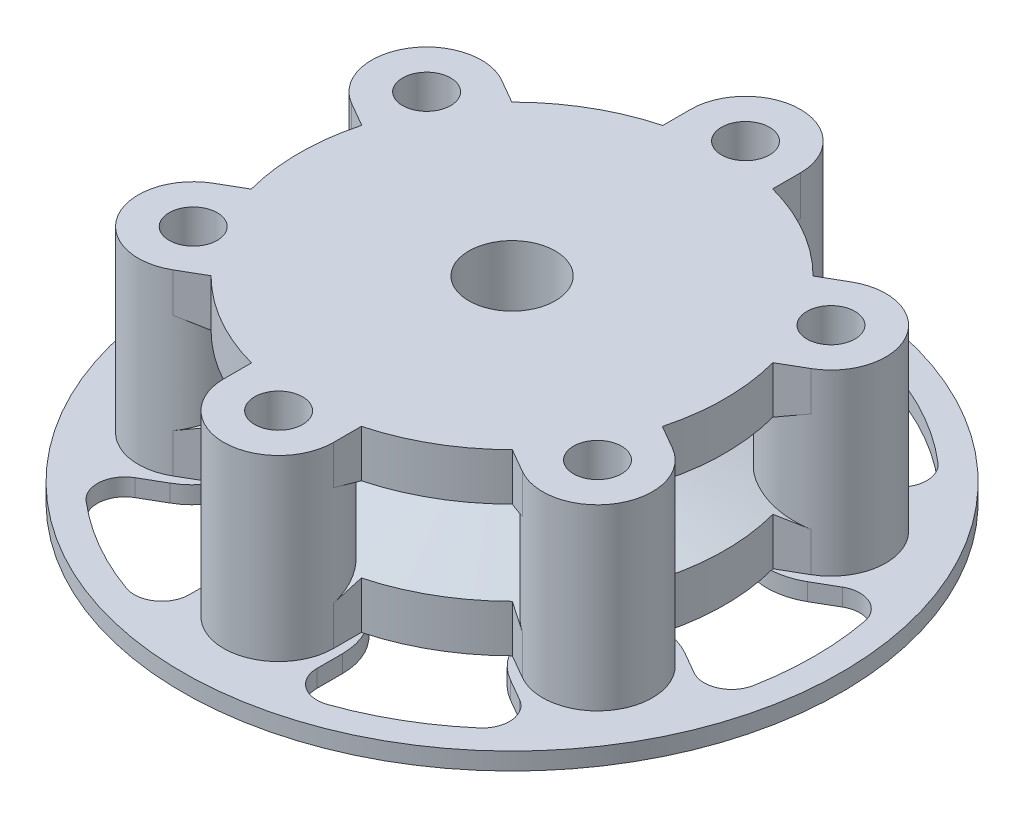
from build123d import *
from build123d.topology import SkipClean

# Parameters (mm, degrees)
SKETCH1_R                = 31.75
BOSS_EXTRUDE1_DEPTH      = 8.255
CUT_EXTRUDE4_DEPTH       = 0.635
CIRPATTERN2_COUNT        = 20
BOSS_EXTRUDE2_REACH      = 46.486
SKETCH5_R                = 5.08
SKETCH5_R_2              = 2.2225
BOSS_EXTRUDE6_REACH      = 46.486
SKETCH12_R               = 5.08
SKETCH17_R               = 2.2225
CUT_EXTRUDE5_DEPTH       = 43.125921197
CIRPATTERN1_COUNT        = 3
BOSS_EXTRUDE9_REACH      = 41.36
SKETCH18_R               = 10.16
FILLET5_R                = 1.27
SKETCH24_R               = 4
CUT_EXTRUDE7_DEPTH       = 40.360360407
SKETCH30_R               = 30.48
SKETCH30_R_2             = 27.94
BOSS_EXTRUDE16_DEPTH     = 1.6002
SKETCH31_R               = 2.7305
BOSS_EXTRUDE17_DEPTH     = 1.6002
FILLET6_R                = 2.54
CIRPATTERN8_COUNT        = 6
FILLET6_OF_CIRPATTERN8_R = 2.54


with BuildPart() as part:
    # Sketch1 → Boss-Extrude1 (new, symmetric)
    with BuildSketch(Plane(origin=(0, 0, 0), x_dir=(1, 0, 0), z_dir=(0, 1, 0))):
        with Locations(Location((0, 0, 0), (0, 0, 270))):
            Circle(SKETCH1_R)
    extrude(amount=BOSS_EXTRUDE1_DEPTH, both=True)

    # Sketch9 → Cut-Extrude4 (cut)
    with BuildSketch(Plane.ZY.offset(31.75)):
        Polygon((-0.635, -8.255), (0.635, -8.255), (0.635, 0), (0.635, 8.255), (-0.635, 8.255), (-0.635, 0), align=None)
    cut_extrude4 = extrude(amount=-CUT_EXTRUDE4_DEPTH, mode=Mode.SUBTRACT)

    # CirPattern2: Cut-Extrude4 ×20 about axis
    cirpattern2_axis = Axis((0, 0, 0), (0, 1, 0))
    for i in range(1, CIRPATTERN2_COUNT):
        add(cut_extrude4.rotate(cirpattern2_axis, i * 360 / CIRPATTERN2_COUNT), mode=Mode.SUBTRACT)

    # Sketch4 → Cut-Revolve2 (revolve, cut)
    with BuildSketch(Plane.XY, mode=Mode.PRIVATE) as cut_revolve2_sk:
        Polygon((-31.75, -8.255), (-29.21, -8.255), (-29.21, -6.6675), (-6.35, 0), (-29.21, 6.6675), (-29.21, 8.255), (-31.75, 8.255), align=None)
    revolve(cut_revolve2_sk.sketch.rotate(Axis((0, -9.433909364, 0), (0, 1, 0)), 270), axis=Axis((0, -9.433909364, 0), (0, 1, 0)), mode=Mode.SUBTRACT)

    # Sketch5 → Boss-Extrude2 (add, up to next)
    with BuildSketch(Plane(origin=(0, 8.255, 0), x_dir=(1, 0, 0), z_dir=(0, 1, 0)), mode=Mode.PRIVATE) as boss_extrude2_sk1:
        with Locations(Location((0, 21.59, 0), (0, 0, 269.999999942))):
            Circle(SKETCH5_R)
        with Locations(Location((0, 21.59, 0), (0, 0, 138.641608493))):
            Circle(SKETCH5_R_2, mode=Mode.SUBTRACT)
    boss_extrude2_tool1 = extrude(boss_extrude2_sk1.sketch, amount=-BOSS_EXTRUDE2_REACH, mode=Mode.PRIVATE) - part.part
    boss_extrude2 = boss_extrude2_tool1.solids().sort_by_distance((0, 8.255, -26.526316))[0]
    add(boss_extrude2)

    # Sketch12 → Boss-Extrude6 (add, up to next)
    with BuildSketch(Plane(origin=(0, 8.255, 0), x_dir=(1, 0, 0), z_dir=(0, 1, 0)), mode=Mode.PRIVATE) as boss_extrude6_sk1:
        with Locations(Location((-18.697488468, 10.795, 0), (0, 0, 134.395917387))):
            Circle(SKETCH12_R)
    boss_extrude6_tool1 = extrude(boss_extrude6_sk1.sketch, amount=-BOSS_EXTRUDE6_REACH, mode=Mode.PRIVATE) - part.part
    boss_extrude6 = boss_extrude6_tool1.solids().sort_by_distance((-18.697488, 8.255, -10.795))[0]
    add(boss_extrude6)

    # Sketch17 → Cut-Extrude5 (cut, symmetric)
    with SkipClean():  # the faces are left unmerged after this step: merging them gives an invalid solid
        with BuildSketch(Plane(origin=(0, 0, 0), x_dir=(1, 0, 0), z_dir=(0, 1, 0))):
            with Locations(Location((0, 21.59, 0), (0, 0, 270))):
                Circle(SKETCH17_R)
            with Locations(Location((-18.697488468, 10.795, 0), (0, 0, 270))):
                Circle(SKETCH17_R)
            with Locations(Location((-18.697488468, -10.795, 0), (0, 0, 270))):
                Circle(SKETCH17_R)
            with BuildLine():
                Line((-23.096897519, -13.335), (-25.296602045, -14.605))
                ThreePointArc((-25.296602045, -14.605), (-25.296602045, 14.605), (0, 29.21))
                Line((0, 29.21), (0, 26.67))
                ThreePointArc((0, 26.67), (-3.592102448, 25.182102448), (-5.08, 21.59))
                Line((-5.08, 21.59), (-5.08, 19.018223497))
                ThreePointArc((-5.08, 19.018223497), (-9.8425, 17.047710073), (-13.930264684, 13.9085208))
                Line((-13.930264684, 13.9085208), (-16.157488468, 15.194409051))
                ThreePointArc((-16.157488468, 15.194409051), (-23.096897519, 13.335), (-21.237488468, 6.395590949))
                Line((-21.237488468, 6.395590949), (-19.010264684, 5.109702698))
                ThreePointArc((-19.010264684, 5.109702698), (-19.685, 0), (-19.010264684, -5.109702698))
                Line((-19.010264684, -5.109702698), (-21.237488468, -6.395590949))
                ThreePointArc((-21.237488468, -6.395590949), (-23.604391665, -9.480199251), (-23.096897519, -13.335))
            make_face()
        cut_extrude5 = extrude(amount=CUT_EXTRUDE5_DEPTH, both=True, mode=Mode.SUBTRACT)

    # CirPattern1: Boss-Extrude2, Boss-Extrude6, Cut-Extrude5 ×3 about axis
    with SkipClean():  # the faces are left unmerged after this step: merging them gives an invalid solid
        cirpattern1_axis = Axis((0, 0, 0), (0, 1, 0))
        add([boss_extrude2.rotate(cirpattern1_axis, i * 360 / CIRPATTERN1_COUNT) for i in range(1, CIRPATTERN1_COUNT)])
        add([boss_extrude6.rotate(cirpattern1_axis, i * 360 / CIRPATTERN1_COUNT) for i in range(1, CIRPATTERN1_COUNT)])
        add([cut_extrude5.rotate(cirpattern1_axis, i * 360 / CIRPATTERN1_COUNT) for i in range(1, CIRPATTERN1_COUNT)], mode=Mode.SUBTRACT)

    # Sketch18 → Boss-Extrude9 (add, up to next)
    with BuildSketch(Plane.XZ.offset(8.255), mode=Mode.PRIVATE) as boss_extrude9_sk1:
        with Locations(Location((0, 0, 0), (0, 0, 270))):
            Circle(SKETCH18_R)
    boss_extrude9_tool1 = extrude(boss_extrude9_sk1.sketch, amount=-BOSS_EXTRUDE9_REACH, mode=Mode.PRIVATE) - part.part
    add(boss_extrude9_tool1.solids().sort_by_distance((0, -8.255, 0))[0])

    # Fillet5
    fillet5_edges = [part.edges().sort_by_distance(p)[0] for p in [
        (0, 1.11125, 10.16),
        (0, -1.11125, 10.16),
    ]]
    fillet(fillet5_edges, radius=FILLET5_R)

    # Sketch24 → Cut-Extrude7 (cut, through all)
    with SkipClean():  # the faces are left unmerged after this step: merging them gives an invalid solid
        with BuildSketch(Plane.XZ.offset(8.255)):
            with Locations(Location((0, 0, 0), (0, 0, 270))):
                Circle(SKETCH24_R)
        extrude(amount=-CUT_EXTRUDE7_DEPTH, mode=Mode.SUBTRACT)


with BuildPart() as body_2:
    # Sketch30 → Boss-Extrude16 (new body)
    with BuildSketch(Plane.XZ.offset(8.255)):
        with Locations(Location((0, 0, 0), (0, 0, 270))):
            Circle(SKETCH30_R)
        with Locations(Location((0, 0, 0), (0, 0, 270))):
            Circle(SKETCH30_R_2, mode=Mode.SUBTRACT)
    extrude(amount=BOSS_EXTRUDE16_DEPTH)

    # Sketch31 → Boss-Extrude17 (add)
    with BuildSketch(Plane.XZ.offset(9.8552)):
        with BuildLine():
            Line((-5.9055, 21.59), (-5.9055, 29.902432506))
            Line((-5.9055, 29.902432506), (5.9055, 29.902432506))
            Line((5.9055, 29.902432506), (5.9055, 21.59))
            ThreePointArc((5.9055, 21.59), (0, 15.6845), (-5.9055, 21.59))
        make_face()
        with Locations(Location((0, 21.59, 0), (0, 0, 270))):
            Circle(SKETCH31_R, mode=Mode.SUBTRACT)
    boss_extrude17 = extrude(amount=-BOSS_EXTRUDE17_DEPTH)

    # Fillet6
    fillet6_edges = [body_2.edges().sort_by_distance(p)[0] for p in [
        (-5.9055, -9.0551, 27.308765438),
        (5.9055, -9.0551, 27.308765438),
    ]]
    fillet(fillet6_edges, radius=FILLET6_R)

    # CirPattern8: Boss-Extrude17 ×6 about axis
    cirpattern8_axis = Axis((0, 0, 0), (0, 1, 0))
    for i in range(1, CIRPATTERN8_COUNT):
        add(boss_extrude17.rotate(cirpattern8_axis, i * 360 / CIRPATTERN8_COUNT))

    # Fillet6 of CirPattern8
    fillet6_of_cirpattern8_edges = [body_2.edges().sort_by_distance(p)[0] for p in [
        (20.697334615, -9.0551, 18.768695741),
        (26.602834615, -9.0551, 8.540069697),
        (26.602834615, -9.0551, -8.540069697),
        (20.697334615, -9.0551, -18.768695741),
        (5.9055, -9.0551, -27.308765438),
        (-5.9055, -9.0551, -27.308765438),
        (-20.697334615, -9.0551, -18.768695741),
        (-26.602834615, -9.0551, -8.540069697),
        (-26.602834615, -9.0551, 8.540069697),
        (-20.697334615, -9.0551, 18.768695741),
    ]]
    fillet(fillet6_of_cirpattern8_edges, radius=FILLET6_OF_CIRPATTERN8_R)


solid = Compound([part.part, body_2.part])
